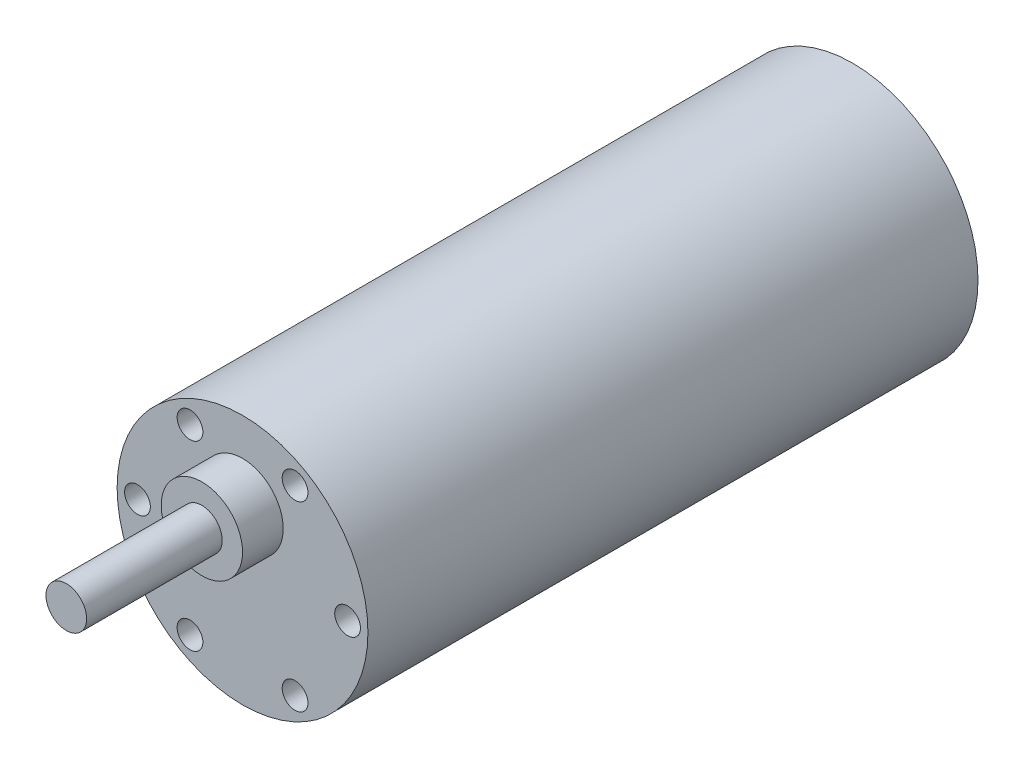
from build123d import *

# Parameters (mm, degrees)
SKETCH1_R           = 18.5
BOSS_EXTRUDE1_DEPTH = 90
SKETCH2_R           = 1.9
CUT_EXTRUDE1_DEPTH  = 3
SKETCH2_3_R         = 6
BOSS_EXTRUDE2_DEPTH = 6
SKETCH3_R           = 3
BOSS_EXTRUDE3_DEPTH = 20


with BuildPart() as part:
    # Sketch1 → Boss-Extrude1 (new body)
    with BuildSketch(Plane(origin=(0, 0, 0), x_dir=(0, 1, 0), z_dir=(0, 0, 1))):
        Circle(SKETCH1_R)
    extrude(amount=BOSS_EXTRUDE1_DEPTH)

    # Sketch2 → Cut-Extrude1 (cut)
    with BuildSketch(Plane(origin=(0, 0, 90), x_dir=(-1, 0, 0), z_dir=(0, 0, 1))):
        with Locations((-15.5, 0)):
            Circle(SKETCH2_R)
        with Locations((-7.75, 13.423393759)):
            Circle(SKETCH2_R)
        with Locations((7.75, 13.423393759)):
            Circle(SKETCH2_R)
        with Locations((15.5, 0)):
            Circle(SKETCH2_R)
        with Locations((7.75, -13.423393759)):
            Circle(SKETCH2_R)
        with Locations((-7.75, -13.423393759)):
            Circle(SKETCH2_R)
    extrude(amount=-CUT_EXTRUDE1_DEPTH, mode=Mode.SUBTRACT)

    # Sketch2<3> → Boss-Extrude2 (add)
    with BuildSketch(Plane(origin=(0, 0, 90), x_dir=(-1, 0, 0), z_dir=(0, 0, 1))):
        with Locations((0, -7)):
            Circle(SKETCH2_3_R)
    extrude(amount=BOSS_EXTRUDE2_DEPTH)

    # Sketch3 → Boss-Extrude3 (add)
    with BuildSketch(Plane.XY.offset(96)):
        with Locations((0, 7)):
            Circle(SKETCH3_R)
    extrude(amount=BOSS_EXTRUDE3_DEPTH)


solid = part.part
